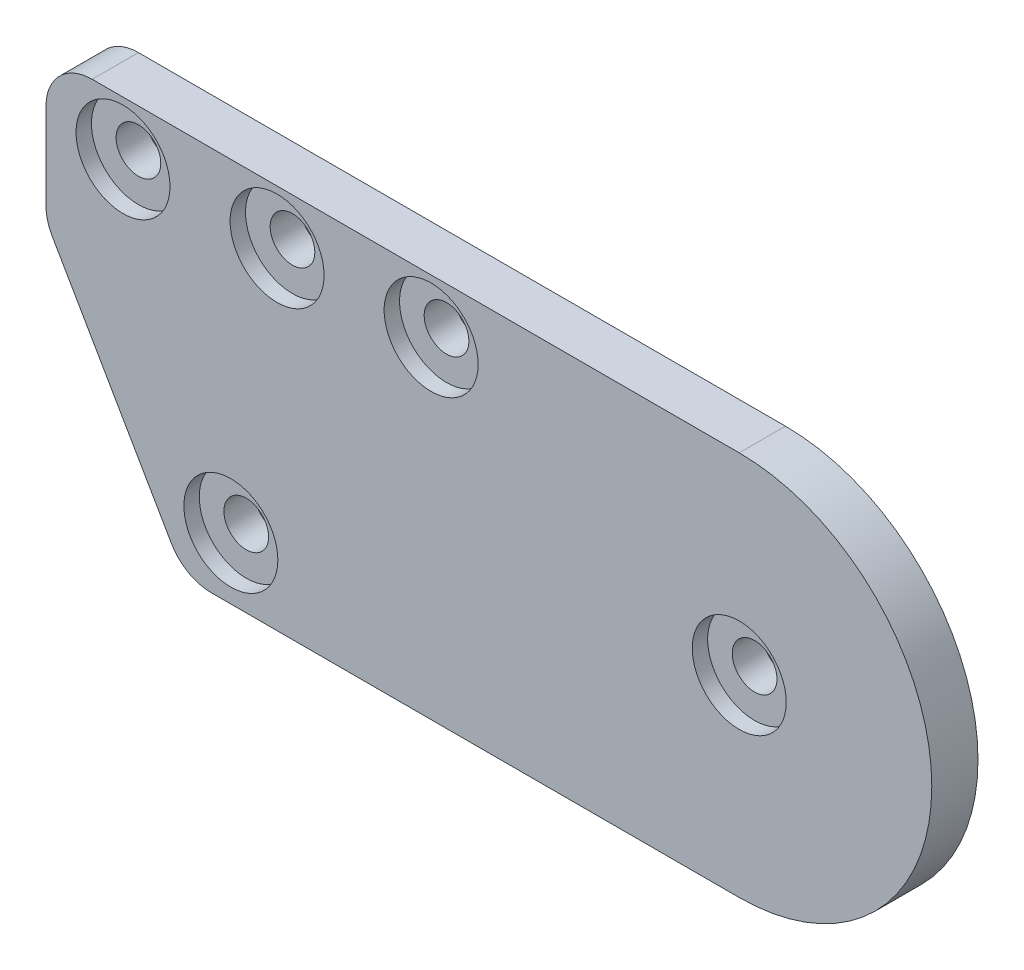
from build123d import *

# Parameters (mm, degrees)
SKETCH_2_R          = 1.45
EXTRUDE_1_DEPTH     = 3
SKETCH_3_R          = 1.45
EXTRUDE_2_DEPTH     = 3
SKETCH_5_R          = 3.05
CUT_EXTRUDE_1_DEPTH = 1
EXTRUDE_3_DEPTH     = 3
SKETCH_7_R          = 3.05
CUT_EXTRUDE_4_DEPTH = 1
FILLET_1_R          = 3
SKETCH_10_R         = 3.05
CUT_EXTRUDE_6_DEPTH = 1


with BuildPart() as part:
    # 草图2 → 凸台-拉伸1 (new body)
    with BuildSketch(Plane.XY):
        with BuildLine():
            Line((-10, -7), (-10, -16.423561614))
            Line((-10, -16.423561614), (30.724748208, -31.24615776))
            ThreePointArc((30.724748208, -31.24615776), (47.310096913, -21.670602221), (35, -7))
            Line((35, -7), (-10, -7))
        make_face()
        with Locations((35, -19.5)):
            Circle(SKETCH_2_R, mode=Mode.SUBTRACT)
        with Locations((15, -10.5)):
            Circle(SKETCH_2_R, mode=Mode.SUBTRACT)
        with Locations((5, -10.5)):
            Circle(SKETCH_2_R, mode=Mode.SUBTRACT)
        with Locations((-5, -10.5)):
            Circle(SKETCH_2_R, mode=Mode.SUBTRACT)
    extrude(amount=EXTRUDE_1_DEPTH)

    # 草图3 → 凸台-拉伸2 (add)
    with BuildSketch(Plane.XY.offset(3)):
        Polygon((-10, -16.423561614), (32.795912741, -32), (-1.006939105, -32), align=None)
        with Locations((2, -28)):
            Circle(SKETCH_3_R, mode=Mode.SUBTRACT)
    extrude(amount=-EXTRUDE_2_DEPTH)

    # 草图5 → 切除-拉伸1 (cut)
    with BuildSketch(Plane.XY.offset(3)):
        with Locations((-5, -10.5)):
            Circle(SKETCH_5_R)
        with Locations((5, -10.5)):
            Circle(SKETCH_5_R)
        with Locations((15, -10.5)):
            Circle(SKETCH_5_R)
    extrude(amount=-CUT_EXTRUDE_1_DEPTH, mode=Mode.SUBTRACT)

    # 草图8 → 凸台-拉伸3 (add)
    with BuildSketch(Plane.XY.offset(3)):
        Polygon((32.795912741, -32), (35, -32), (30.724748208, -31.24615776), align=None)
    extrude(amount=-EXTRUDE_3_DEPTH)

    # 草图7 → 切除-拉伸4 (cut)
    with BuildSketch(Plane.XY.offset(3)):
        with Locations((2, -28)):
            Circle(SKETCH_7_R)
    extrude(amount=-CUT_EXTRUDE_4_DEPTH, mode=Mode.SUBTRACT)

    # 圆角1
    fillet_1_edges = [part.edges().sort_by_distance(p)[0] for p in [
        (-1.006939105, -32, 1.5),
        (-10, -16.423561614, 1.5),
        (-10, -7, 1.5),
    ]]
    fillet(fillet_1_edges, radius=FILLET_1_R)

    # 草图10 → 切除-拉伸6 (cut)
    with BuildSketch(Plane.XY.offset(3)):
        with Locations((35, -19.5)):
            Circle(SKETCH_10_R)
    extrude(amount=-CUT_EXTRUDE_6_DEPTH, mode=Mode.SUBTRACT)


solid = part.part
